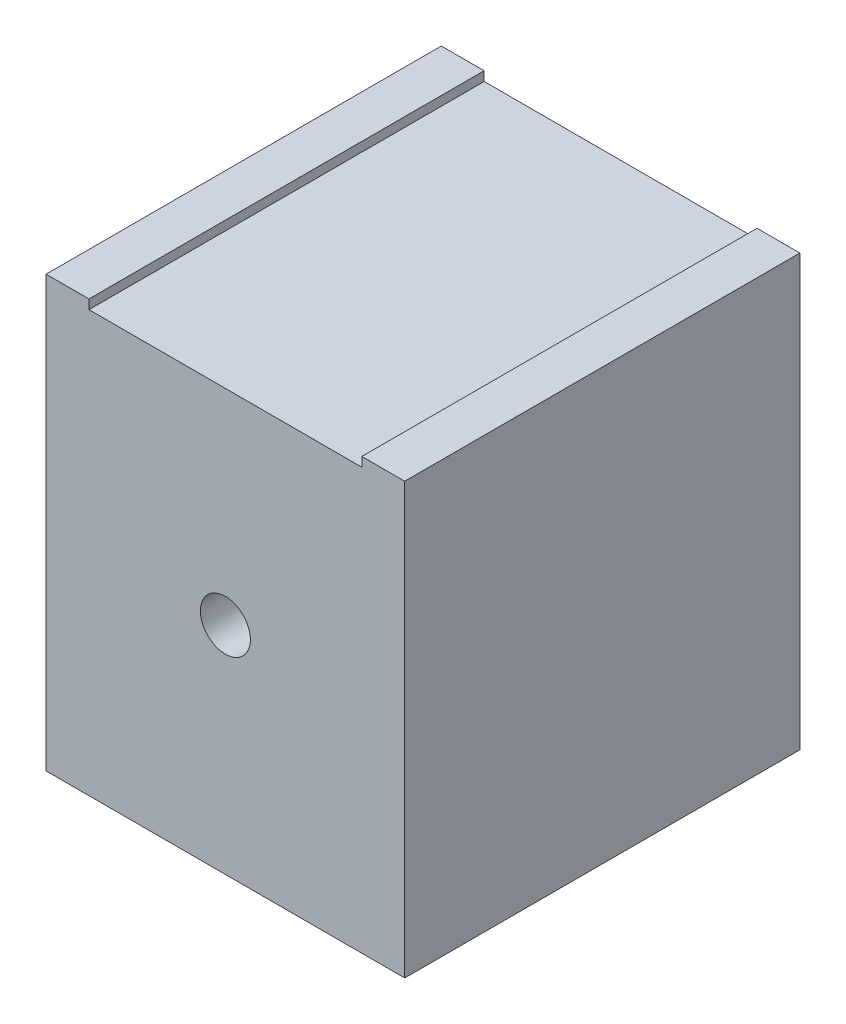
from build123d import *

# Parameters (mm, degrees)
SKETCH1_W                 = 50.18
SKETCH1_H                 = 60.2
BOSS_EXTRUDE1_DEPTH       = 55.3
SKETCH2_W                 = 38.18
SKETCH2_H                 = 55.3
CUT_EXTRUDE1_DEPTH        = 1.3
M8X1_0_TAPPED_HOLE1_D     = 7
M8X1_0_TAPPED_HOLE1_DEPTH = 10
M8X1_0_TAPPED_HOLE1_TIP   = 2.103012167


with BuildPart() as part:
    # Sketch1 → Boss-Extrude1 (new body)
    with BuildSketch(Plane.XY):
        with Locations((25.09, 30.1)):
            Rectangle(SKETCH1_W, SKETCH1_H)
    extrude(amount=BOSS_EXTRUDE1_DEPTH)

    # Sketch2 → Cut-Extrude1 (cut)
    with BuildSketch(Plane(origin=(0, 60.2, 0), x_dir=(1, 0, 0), z_dir=(0, 1, 0))):
        with Locations((25.09, -27.65)):
            Rectangle(SKETCH2_W, SKETCH2_H)
    extrude(amount=-CUT_EXTRUDE1_DEPTH, mode=Mode.SUBTRACT)

    # M8x1.0 Tapped Hole1
    with Locations(Plane.XY.offset(55.3)):
        with Locations((25.09, 30.2)):
            Hole(M8X1_0_TAPPED_HOLE1_D / 2, depth=M8X1_0_TAPPED_HOLE1_DEPTH)
            with Locations((0, 0, -(M8X1_0_TAPPED_HOLE1_DEPTH + M8X1_0_TAPPED_HOLE1_TIP / 2))):  # 118° drill point
                Cone(0, M8X1_0_TAPPED_HOLE1_D / 2, M8X1_0_TAPPED_HOLE1_TIP, mode=Mode.SUBTRACT)


solid = part.part
